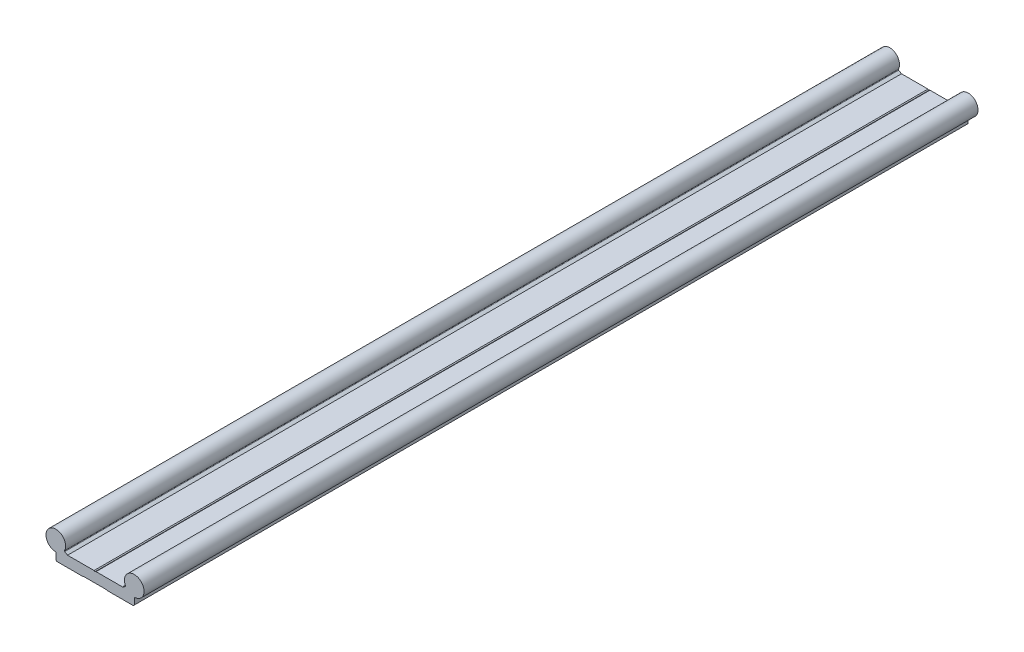
from build123d import *

# Parameters (mm, degrees)
BOSS_EXTRUDE1_DEPTH = 425


with BuildPart() as part:
    # Sketch1 → Boss-Extrude1 (new body)
    with BuildSketch(Plane.XY.offset(425)):
        with BuildLine():
            Line((-20, 0.5), (-19.5, 0))
            Line((-19.5, 0), (-6, 0))
            Line((-6, 0), (-5.8, 0.2))
            Line((-5.8, 0.2), (5.8, 0.2))
            Line((5.8, 0.2), (6, 0))
            Line((6, 0), (19.5, 0))
            Line((19.5, 0), (20, 0.5))
            Line((20, 0.5), (20, 3.708496771))
            ThreePointArc((20, 3.708496771), (20.081946856, 3.914537598), (20.283018838, 4.008015763))
            ThreePointArc((20.283018838, 4.008015763), (22.487270957, 13.337451356), (15.548604796, 6.722921305))
            ThreePointArc((15.548604796, 6.722921305), (15.569235136, 6.501321924), (15.431520983, 6.326488551))
            Line((15.431520983, 6.326488551), (13.999999829, 5.499999462))
            Line((13.999999829, 5.499999462), (0.499999829, 5.499999462))
            Line((0.499999829, 5.499999462), (-1.71e-07, 5.211324462))
            Line((-1.71e-07, 5.211324462), (-0.500000171, 5.499999462))
            Line((-0.500000171, 5.499999462), (-14.000000171, 5.499999462))
            Line((-14.000000171, 5.499999462), (-15.431521324, 6.326488551))
            ThreePointArc((-15.431521324, 6.326488551), (-15.569235521, 6.501321979), (-15.548605174, 6.72292143))
            ThreePointArc((-15.548605174, 6.72292143), (-22.487271055, 13.33745115), (-20.283018868, 4.008016016))
            ThreePointArc((-20.283018868, 4.008016016), (-20.081946865, 3.914537846), (-20, 3.708497))
            Line((-20, 3.708497), (-20, 0.5))
        make_face()
    extrude(amount=-BOSS_EXTRUDE1_DEPTH)


solid = part.part
